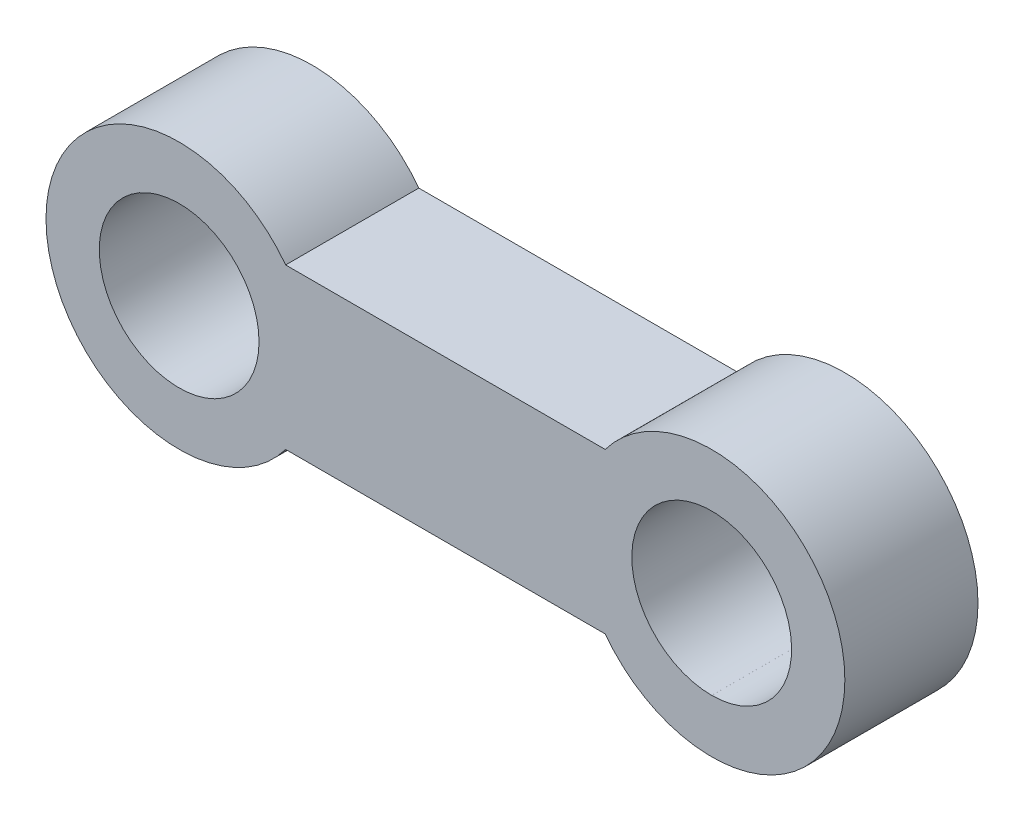
from build123d import *

# Parameters (mm, degrees)
SKETCH_1_R      = 3
EXTRUDE_1_DEPTH = 5


with BuildPart() as part:
    # 草图1 → 凸台-拉伸1 (new body)
    with BuildSketch(Plane.XY):
        with BuildLine():
            Line((4, 3), (16, 3))
            ThreePointArc((16, 3), (25, 0), (16, -3))
            Line((16, -3), (4, -3))
            ThreePointArc((4, -3), (-5, 0), (4, 3))
        make_face()
        Circle(SKETCH_1_R, mode=Mode.SUBTRACT)
        with Locations((20, 0)):
            Circle(SKETCH_1_R, mode=Mode.SUBTRACT)
    extrude(amount=EXTRUDE_1_DEPTH)


solid = part.part
